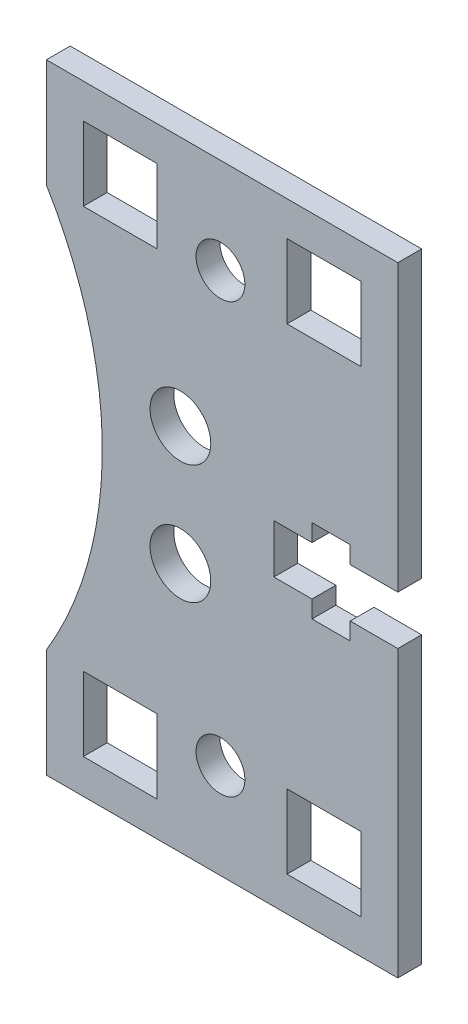
from build123d import *

# Parameters (mm, degrees)
SKETCH_1_R      = 2.55
SKETCH_1_R_2    = 2.05
SKETCH_1_W      = 6.2
SKETCH_1_H      = 6.2
EXTRUDE_1_DEPTH = 2


with BuildPart() as part:
    # 草图1 → 凸台-拉伸1 (new body)
    with BuildSketch(Plane.XY):
        with BuildLine():
            Line((53.016222961, -26), (23.516222961, -26))
            Line((23.516222961, -26), (23.516222961, -16.9))
            ThreePointArc((23.516222961, -16.9), (28.210668367, 0), (23.516222961, 16.9))
            Line((23.516222961, 16.9), (23.516222961, 26))
            Line((23.516222961, 26), (53.016222961, 26))
            Line((53.016222961, 26), (53.016222961, 2.05))
            Line((53.016222961, 2.05), (49.016222961, 2.05))
            Line((49.016222961, 2.05), (49.016222961, 3.5))
            Line((49.016222961, 3.5), (45.816222961, 3.5))
            Line((45.816222961, 3.5), (45.816222961, 2.05))
            Line((45.816222961, 2.05), (42.616222961, 2.05))
            Line((42.616222961, 2.05), (42.616222961, -2.05))
            Line((42.616222961, -2.05), (45.816222961, -2.05))
            Line((45.816222961, -2.05), (45.816222961, -3.5))
            Line((45.816222961, -3.5), (49.016222961, -3.5))
            Line((49.016222961, -3.5), (49.016222961, -2.05))
            Line((49.016222961, -2.05), (53.016222961, -2.05))
            Line((53.016222961, -2.05), (53.016222961, -26))
        make_face()
        with Locations((34.766222961, 5)):
            Circle(SKETCH_1_R, mode=Mode.SUBTRACT)
        with Locations((38.129788434, -18)):
            Circle(SKETCH_1_R_2, mode=Mode.SUBTRACT)
        with Locations(Location((34.766222961, -5, 0), (0, 0, 180))):
            Circle(SKETCH_1_R, mode=Mode.SUBTRACT)
        with Locations(Location((38.129788434, 18, 0), (0, 0, 180))):
            Circle(SKETCH_1_R_2, mode=Mode.SUBTRACT)
        with Locations((46.816222961, -20)):
            Rectangle(SKETCH_1_W, SKETCH_1_H, mode=Mode.SUBTRACT)
        with Locations((29.716222961, -20)):
            Rectangle(SKETCH_1_W, SKETCH_1_H, mode=Mode.SUBTRACT)
        with Locations((29.716222961, 20)):
            Rectangle(SKETCH_1_W, SKETCH_1_H, mode=Mode.SUBTRACT)
        with Locations((46.816222961, 20)):
            Rectangle(SKETCH_1_W, SKETCH_1_H, mode=Mode.SUBTRACT)
    extrude(amount=EXTRUDE_1_DEPTH)


solid = part.part
